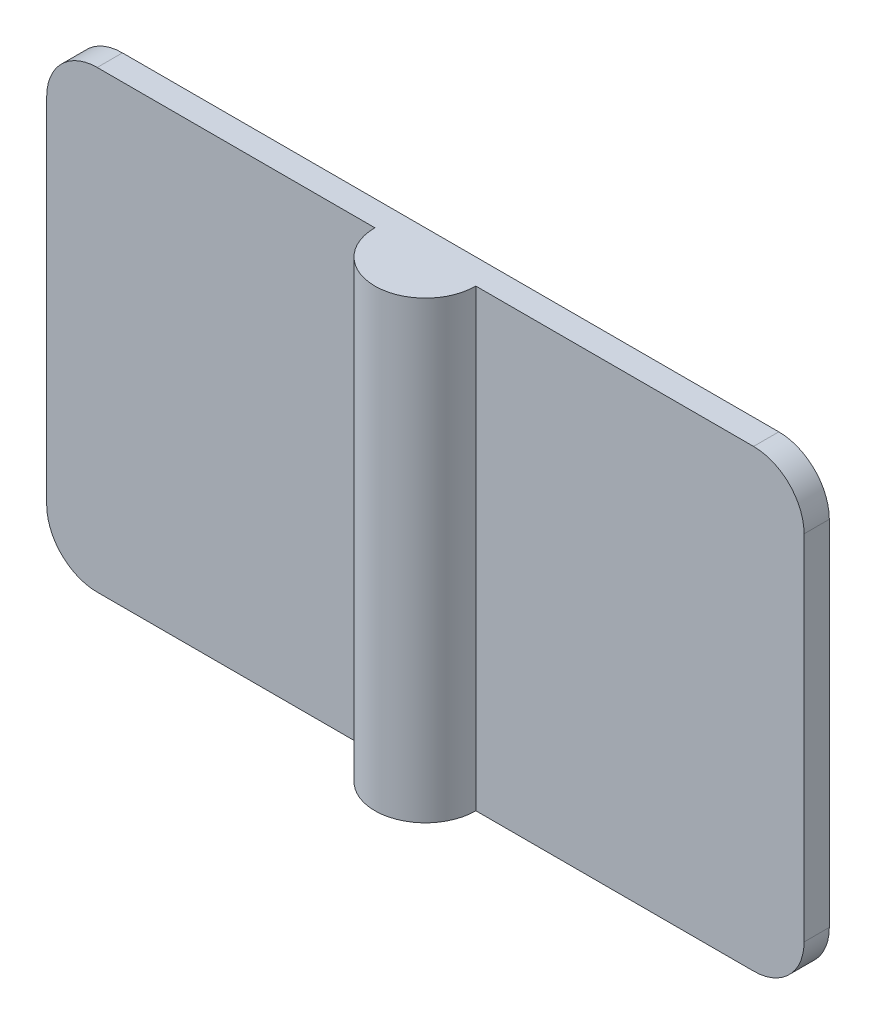
from build123d import *

# Parameters (mm, degrees)
SKETCH1_W           = 30
SKETCH1_H           = 18
BOSS_EXTRUDE1_DEPTH = 1
BOSS_EXTRUDE2_DEPTH = 18
FILLET1_R           = 2


with BuildPart() as part:
    # Sketch1 → Boss-Extrude1 (new body)
    with BuildSketch(Plane.XY):
        with Locations((-439.730210405, -52)):
            Rectangle(SKETCH1_W, SKETCH1_H)
    extrude(amount=BOSS_EXTRUDE1_DEPTH)

    # Sketch2 → Boss-Extrude2 (add)
    with BuildSketch(Plane(origin=(0, -43, 0), x_dir=(1, 0, 0), z_dir=(0, 1, 0))):
        with BuildLine():
            Line((-437.730210405, -1), (-441.730210405, -1))
            ThreePointArc((-441.730210405, -1), (-439.730210405, -3), (-437.730210405, -1))
        make_face()
    extrude(amount=-BOSS_EXTRUDE2_DEPTH)

    # Fillet1
    fillet1_edges = [part.edges().sort_by_distance(p)[0] for p in [
        (-454.730210405, -43, 0.5),
        (-424.730210405, -43, 0.5),
        (-454.730210405, -61, 0.5),
        (-424.730210405, -61, 0.5),
    ]]
    fillet(fillet1_edges, radius=FILLET1_R)


solid = part.part
